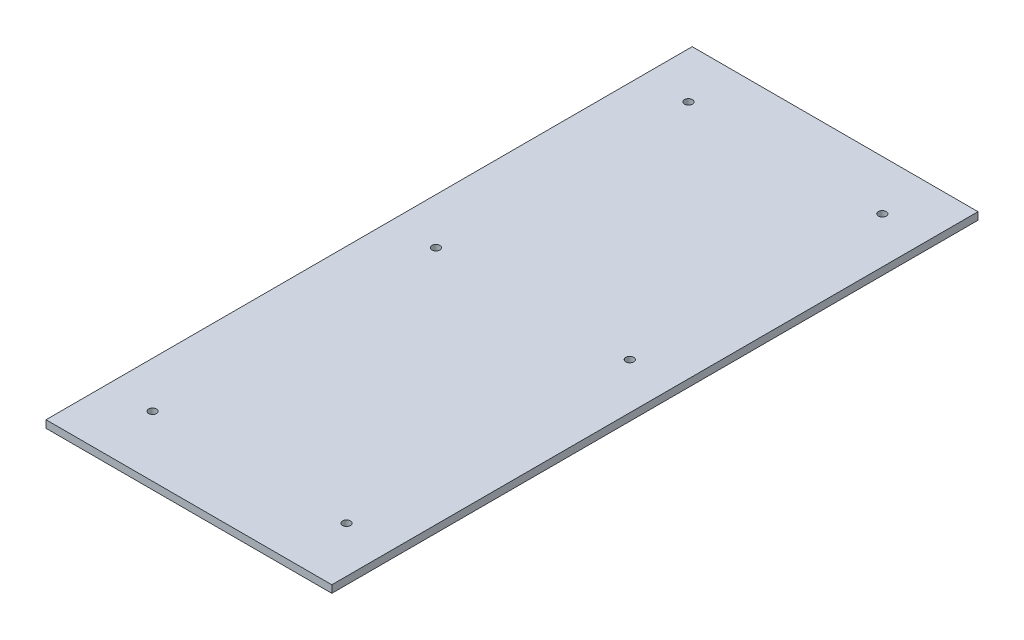
from build123d import *

# Parameters (mm, degrees)
ESQUISSE1_W             = 115
ESQUISSE1_H             = 260
BOSS_EXTRU_1_DEPTH      = 3
ENL_V_MAT_EXTRU_1_REACH = 238.902
ESQUISSE2_R             = 1.6


with BuildPart() as part:
    # Esquisse1 → Boss.-Extru.1 (new body)
    with BuildSketch(Plane(origin=(0, 0, 0), x_dir=(1, 0, 0), z_dir=(0, 1, 0))):
        with Locations((22.5745208, -92.938790058)):
            Rectangle(ESQUISSE1_W, ESQUISSE1_H)
    extrude(amount=BOSS_EXTRU_1_DEPTH)

    # Esquisse2 → Enlèv. mat.-Extru.1 (cut, up to next)
    with BuildSketch(Plane(origin=(0, 3, 0), x_dir=(1, 0, 0), z_dir=(0, 1, 0)), mode=Mode.PRIVATE) as enl_v_mat_extru_1_sk1:
        with Locations(Location((-16.4254792, -198.538790058, 0), (0, 0, 270))):
            Circle(ESQUISSE2_R)
    enl_v_mat_extru_1_tool1 = extrude(enl_v_mat_extru_1_sk1.sketch, amount=-ENL_V_MAT_EXTRU_1_REACH, mode=Mode.PRIVATE) & part.part
    # Esquisse2 → Enlèv. mat.-Extru.1 (cut, up to next)
    with BuildSketch(Plane(origin=(0, 3, 0), x_dir=(1, 0, 0), z_dir=(0, 1, 0)), mode=Mode.PRIVATE) as enl_v_mat_extru_1_sk2:
        with Locations(Location((61.5745208, -198.538790058, 0), (0, 0, 270))):
            Circle(ESQUISSE2_R)
    enl_v_mat_extru_1_tool2 = extrude(enl_v_mat_extru_1_sk2.sketch, amount=-ENL_V_MAT_EXTRU_1_REACH, mode=Mode.PRIVATE) & part.part
    # Esquisse2 → Enlèv. mat.-Extru.1 (cut, up to next)
    with BuildSketch(Plane(origin=(0, 3, 0), x_dir=(1, 0, 0), z_dir=(0, 1, 0)), mode=Mode.PRIVATE) as enl_v_mat_extru_1_sk3:
        with Locations(Location((-16.4254792, -84.538790058, 0), (0, 0, 270))):
            Circle(ESQUISSE2_R)
    enl_v_mat_extru_1_tool3 = extrude(enl_v_mat_extru_1_sk3.sketch, amount=-ENL_V_MAT_EXTRU_1_REACH, mode=Mode.PRIVATE) & part.part
    # Esquisse2 → Enlèv. mat.-Extru.1 (cut, up to next)
    with BuildSketch(Plane(origin=(0, 3, 0), x_dir=(1, 0, 0), z_dir=(0, 1, 0)), mode=Mode.PRIVATE) as enl_v_mat_extru_1_sk4:
        with Locations(Location((61.5745208, -84.538790058, 0), (0, 0, 270))):
            Circle(ESQUISSE2_R)
    enl_v_mat_extru_1_tool4 = extrude(enl_v_mat_extru_1_sk4.sketch, amount=-ENL_V_MAT_EXTRU_1_REACH, mode=Mode.PRIVATE) & part.part
    # Esquisse2 → Enlèv. mat.-Extru.1 (cut, up to next)
    with BuildSketch(Plane(origin=(0, 3, 0), x_dir=(1, 0, 0), z_dir=(0, 1, 0)), mode=Mode.PRIVATE) as enl_v_mat_extru_1_sk5:
        with Locations(Location((-16.4254792, 17.061209942, 0), (0, 0, 270))):
            Circle(ESQUISSE2_R)
    enl_v_mat_extru_1_tool5 = extrude(enl_v_mat_extru_1_sk5.sketch, amount=-ENL_V_MAT_EXTRU_1_REACH, mode=Mode.PRIVATE) & part.part
    # Esquisse2 → Enlèv. mat.-Extru.1 (cut, up to next)
    with BuildSketch(Plane(origin=(0, 3, 0), x_dir=(1, 0, 0), z_dir=(0, 1, 0)), mode=Mode.PRIVATE) as enl_v_mat_extru_1_sk6:
        with Locations(Location((61.5745208, 17.061209942, 0), (0, 0, 270))):
            Circle(ESQUISSE2_R)
    enl_v_mat_extru_1_tool6 = extrude(enl_v_mat_extru_1_sk6.sketch, amount=-ENL_V_MAT_EXTRU_1_REACH, mode=Mode.PRIVATE) & part.part
    add(enl_v_mat_extru_1_tool1.solids().sort_by_distance((-16.425479, 3, 198.53879))[0], mode=Mode.SUBTRACT)
    add(enl_v_mat_extru_1_tool2.solids().sort_by_distance((61.574521, 3, 198.53879))[0], mode=Mode.SUBTRACT)
    add(enl_v_mat_extru_1_tool3.solids().sort_by_distance((-16.425479, 3, 84.53879))[0], mode=Mode.SUBTRACT)
    add(enl_v_mat_extru_1_tool4.solids().sort_by_distance((61.574521, 3, 84.53879))[0], mode=Mode.SUBTRACT)
    add(enl_v_mat_extru_1_tool5.solids().sort_by_distance((-16.425479, 3, -17.06121))[0], mode=Mode.SUBTRACT)
    add(enl_v_mat_extru_1_tool6.solids().sort_by_distance((61.574521, 3, -17.06121))[0], mode=Mode.SUBTRACT)


solid = part.part
